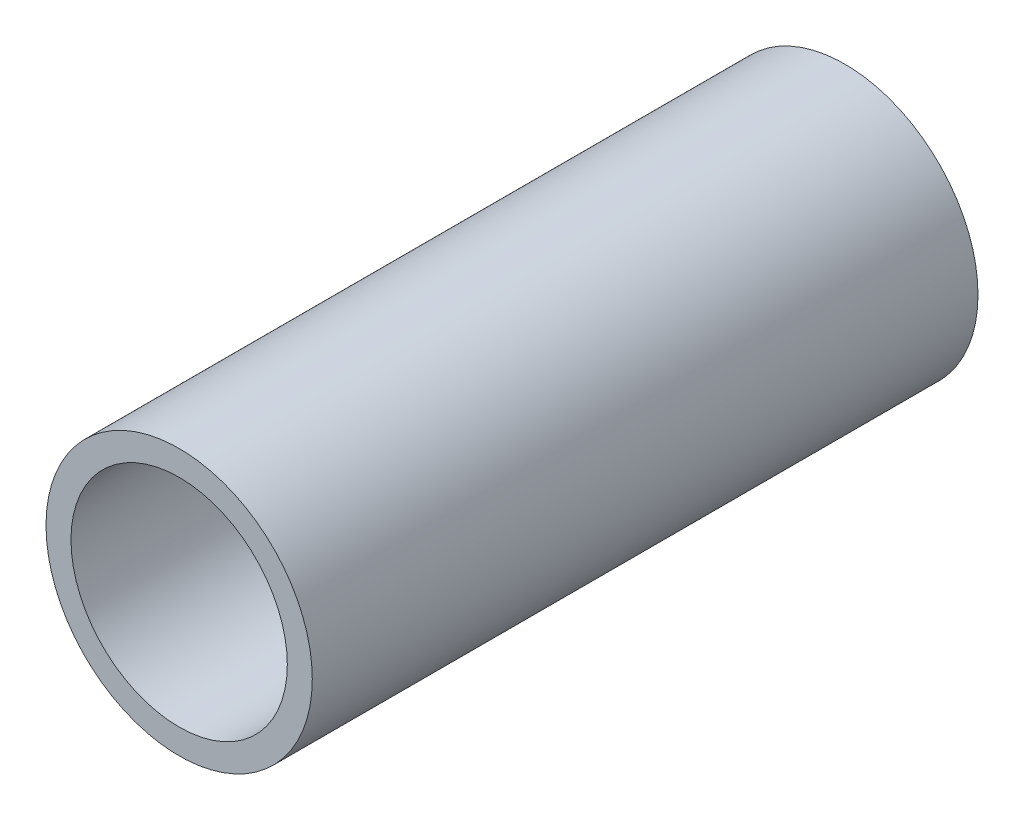
from build123d import *

# Parameters (mm, degrees)
ESQUISSE1_R        = 8
ESQUISSE1_R_2      = 6.5
BOSS_EXTRU_1_DEPTH = 40


with BuildPart() as part:
    # Esquisse1 → Boss.-Extru.1 (new body)
    with BuildSketch(Plane.XY):
        Circle(ESQUISSE1_R)
        Circle(ESQUISSE1_R_2, mode=Mode.SUBTRACT)
    extrude(amount=BOSS_EXTRU_1_DEPTH)


solid = part.part
